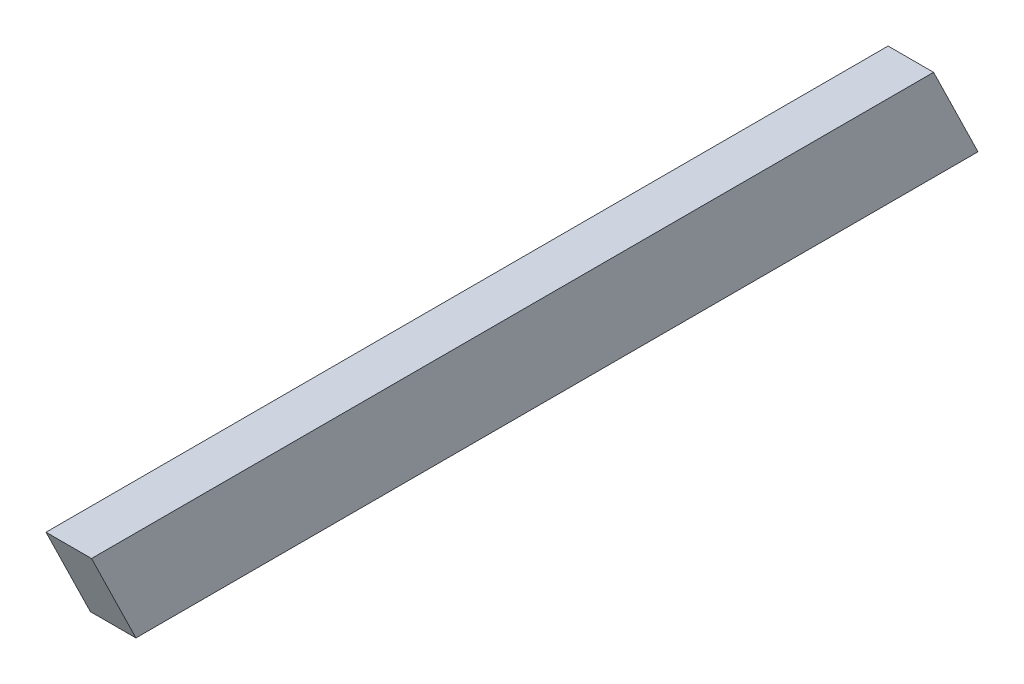
from build123d import *

# Parameters (mm, degrees)
EXTRUDE_1_DEPTH = 20


with BuildPart() as part:
    # Эскиз1 → Бобышка-Вытянуть1 (new body)
    with BuildSketch(Plane(origin=(0, 0, 0), x_dir=(0, 0, -1), z_dir=(1, 0, 0))):
        Polygon((-472.422624343, -114.795204883), (-452.9133208, -154.795204883), (-82.9133208, -154.795204883), (-102.422624343, -114.795204883), align=None)
    extrude(amount=EXTRUDE_1_DEPTH)


solid = part.part
